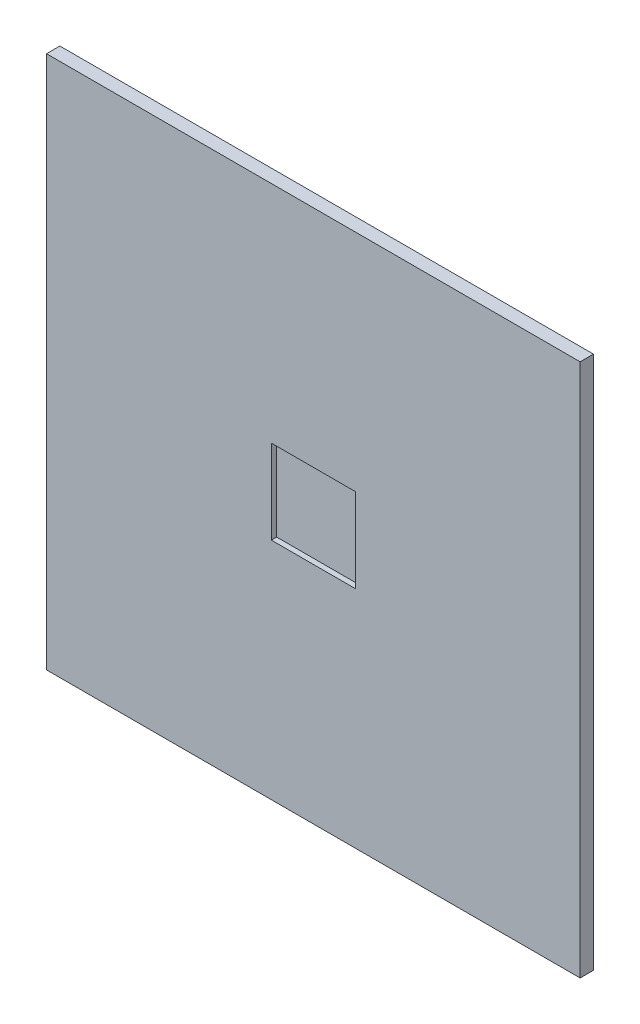
from build123d import *

# Parameters (mm, degrees)
SKETCH1_W           = 40
SKETCH1_H           = 40
SKETCH1_W_2         = 6.3
SKETCH1_H_2         = 6.3
BOSS_EXTRUDE1_DEPTH = 1
PCB_START           = 1
SKETCH1_3_W         = 6.3
SKETCH1_3_H         = 6.3
PCB_DEPTH           = 0.4


with BuildPart() as part:
    # Sketch1 → Boss-Extrude1 (new body)
    # profile 1 of 2: a face of its own
    with BuildSketch(Plane.XY):
        Rectangle(SKETCH1_W, SKETCH1_H)
        Rectangle(SKETCH1_W_2, SKETCH1_H_2, mode=Mode.SUBTRACT)
    # profile 2 of 2: a face of its own
    with BuildSketch(Plane.XY):
        Rectangle(SKETCH1_W_2, SKETCH1_H_2)
    extrude(amount=BOSS_EXTRUDE1_DEPTH)

    # Sketch1<3> → PCB (cut)
    with BuildSketch(Plane.XY.offset(PCB_START)):
        Rectangle(SKETCH1_3_W, SKETCH1_3_H)
    extrude(amount=-PCB_DEPTH, mode=Mode.SUBTRACT)


solid = part.part
